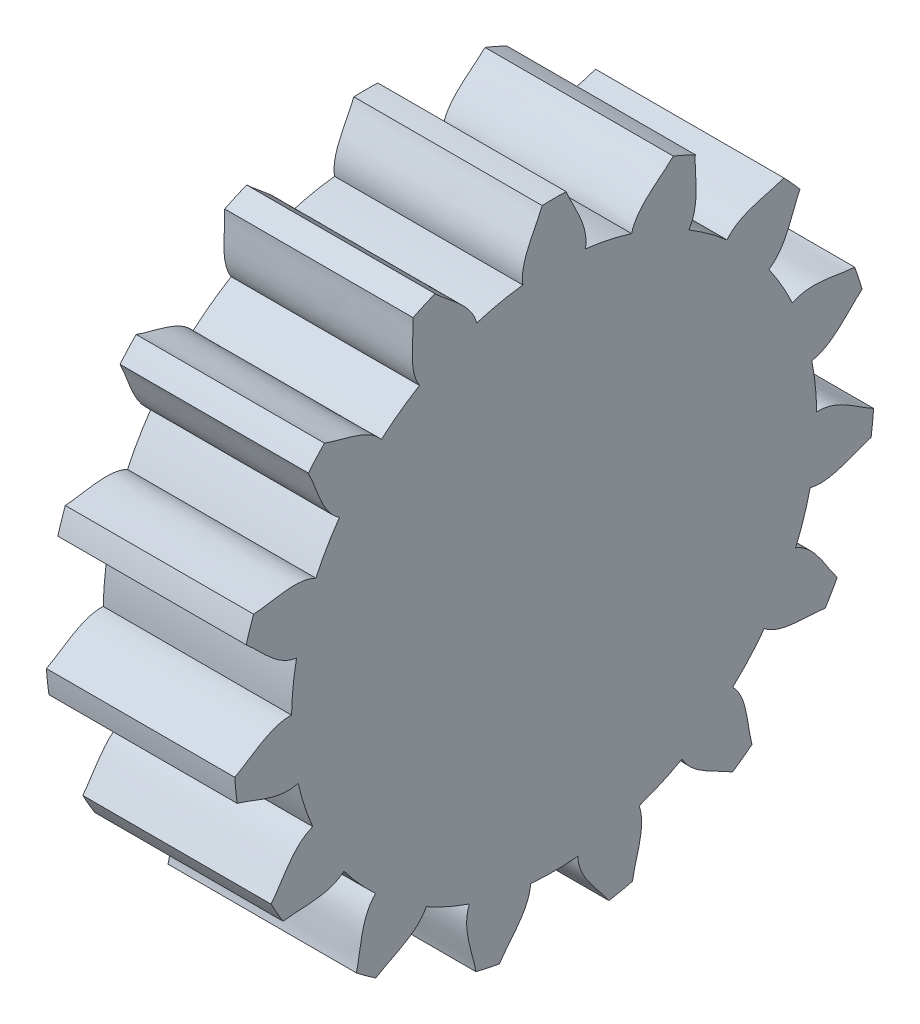
from build123d import *

# Parameters (mm, degrees)
BOSS_EXTRUDE1_DEPTH = 10
CIRPATTERN1_COUNT   = 15


with BuildPart() as part:
    # Sketch3 → Boss-Extrude1 (new body)
    with BuildSketch(Plane.YZ):
        with BuildLine():
            ThreePointArc((-1.141482098, 16.961633725), (-1.776983876, 16.906872221), (-2.409983971, 16.828308806))
            add(Edge.make_bspline(
                [(-2.409983971, 16.828308806), (-2.668426254, 15.877904884), (-3.400287418, 14.680650879), (-3.101338611, 13.595689764)],
                knots=[0.02683822, 0.02683822, 0.02683822, 0.02683822, 1.045667648, 1.045667648, 1.045667648, 1.045667648], degree=3))
            ThreePointArc((-3.101338611, 13.595689764), (1.457642136, -13.868538522), (0.206864074, 13.943395877))
            add(Edge.make_bspline(
                [(-1.141482098, 16.961633725), (-0.691087313, 16.085731582), (0.273704033, 15.066802941), (0.206864074, 13.943395877)],
                knots=[0.02683822, 0.02683822, 0.02683822, 0.02683822, 1.045667648, 1.045667648, 1.045667648, 1.045667648], degree=3))
        make_face()
    boss_extrude1 = extrude(amount=BOSS_EXTRUDE1_DEPTH)

    # CirPattern1: Boss-Extrude1 ×15 about axis
    cirpattern1_axis = Axis((10, 0, 0), (1, 0, 0))
    for i in range(1, CIRPATTERN1_COUNT):
        add(boss_extrude1.rotate(cirpattern1_axis, i * 360 / CIRPATTERN1_COUNT))


solid = part.part
